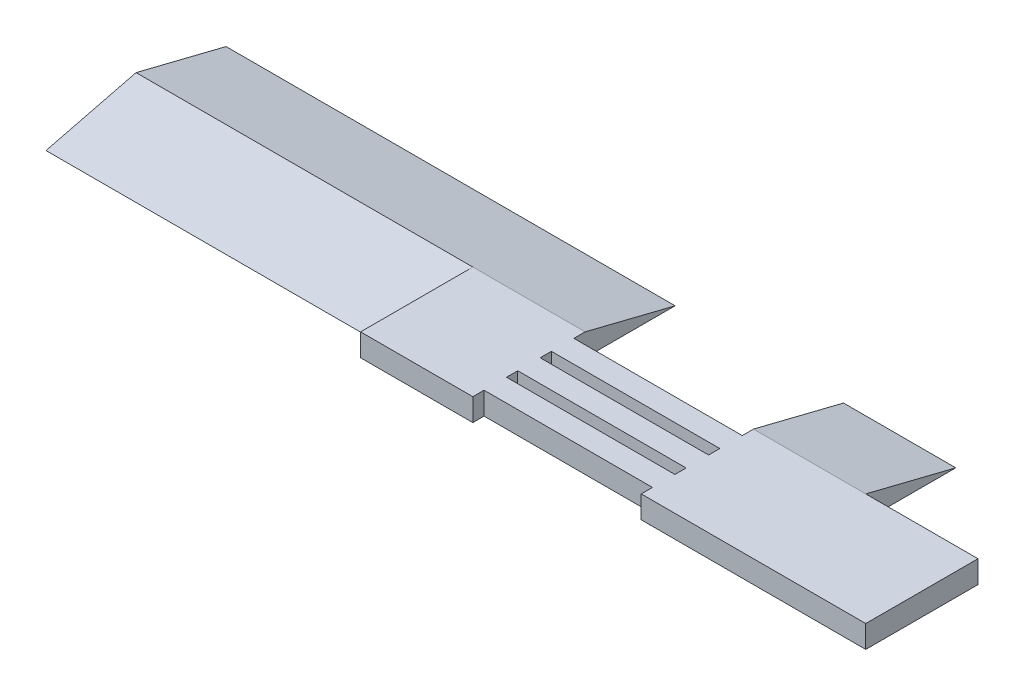
from build123d import *

# Parameters (mm, degrees)
SKETCH_1_W      = 2000
SKETCH_1_H      = 1000
EXTRUDE_1_DEPTH = 200
EXTRUDE_2_DEPTH = 1000
SKETCH_3_W      = 200
SKETCH_3_H      = 200
EXTRUDE_3_DEPTH = 1500
SKETCH_4_W      = 1000
SKETCH_4_H      = 1000
EXTRUDE_4_DEPTH = 200
EXTRUDE_5_DEPTH = 4000


with BuildPart() as part:
    # 草图1 → 凸台-拉伸1 (new body)
    with BuildSketch(Plane(origin=(0, 0, 0), x_dir=(1, 0, 0), z_dir=(0, 1, 0))):
        with Locations((1000, 500)):
            Rectangle(SKETCH_1_W, SKETCH_1_H)
    extrude(amount=EXTRUDE_1_DEPTH)

    # 草图2 → 凸台-拉伸2 (add)
    with BuildSketch(Plane.ZY):
        Polygon((-1000, 200), (-1802.156186707, 0), (-1000, 0), align=None)
    extrude(amount=-EXTRUDE_2_DEPTH)

    # 草图3 → 凸台-拉伸3 (add)
    with BuildSketch(Plane.ZY):
        with Locations((-200, 100)):
            Rectangle(SKETCH_3_W, SKETCH_3_H)
        with Locations((-500, 100)):
            Rectangle(SKETCH_3_W, SKETCH_3_H)
        with Locations((-800, 100)):
            Rectangle(SKETCH_3_W, SKETCH_3_H)
    extrude(amount=EXTRUDE_3_DEPTH)

    # 草图4 → 凸台-拉伸4 (add)
    with BuildSketch(Plane(origin=(0, 0, 0), x_dir=(1, 0, 0), z_dir=(0, 1, 0))):
        with Locations((-2000, 500)):
            Rectangle(SKETCH_4_W, SKETCH_4_H)
    extrude(amount=EXTRUDE_4_DEPTH)

    # 草图5 → 凸台-拉伸5 (add)
    with BuildSketch(Plane(origin=(-1500, 0, 0), x_dir=(0, 0, -1), z_dir=(1, 0, 0))):
        Polygon((1802.156186707, 0), (197.843813293, 0), (1000, 200), align=None)
    extrude(amount=-EXTRUDE_5_DEPTH)


solid = part.part
